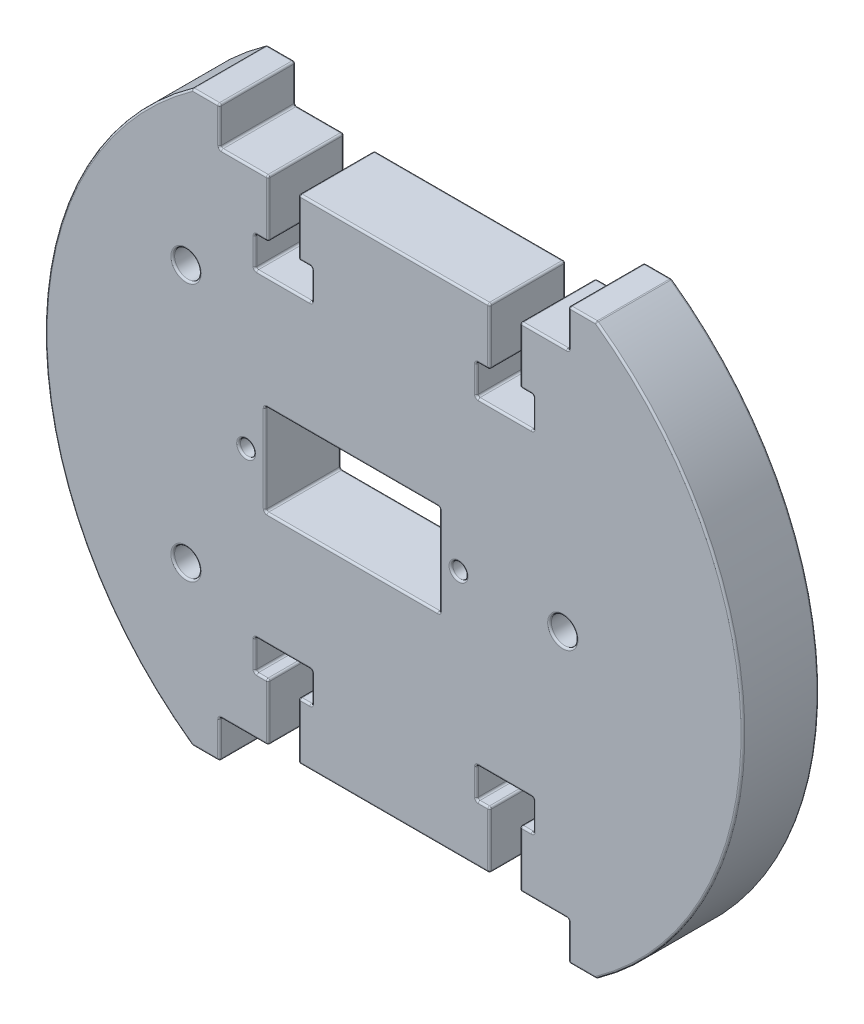
from build123d import *

# Parameters (mm, degrees)
SKETCH1_R           = 1
SKETCH1_R_2         = 1.75
SKETCH1_W           = 23
SKETCH1_H           = 12
BOSS_EXTRUDE1_DEPTH = 10
SKETCH2_W           = 4
SKETCH2_H           = 7.5
SKETCH2_W_2         = 7.5
SKETCH2_H_2         = 4
CUT_EXTRUDE1_DEPTH  = 61.185131054
FILLET1_R           = 0.25


with BuildPart() as part:
    # Sketch1 → Boss-Extrude1 (new body)
    with BuildSketch(Plane.XY):
        with BuildLine():
            Line((26.64113361, 37.5), (23, 37.5))
            Line((23, 37.5), (23, 32.5))
            Line((23, 32.5), (-23, 32.5))
            Line((-23, 32.5), (-23, 37.5))
            Line((-23, 37.5), (-26.64113361, 37.5))
            ThreePointArc((-26.64113361, 37.5), (-46, 0), (-26.64113361, -37.5))
            Line((-26.64113361, -37.5), (-23, -37.5))
            Line((-23, -37.5), (-23, -32.5))
            Line((-23, -32.5), (23, -32.5))
            Line((23, -32.5), (23, -37.5))
            Line((23, -37.5), (26.64113361, -37.5))
            ThreePointArc((26.64113361, -37.5), (46, 0), (26.64113361, 37.5))
        make_face()
        with Locations((8.5, 0)):
            Circle(SKETCH1_R, mode=Mode.SUBTRACT)
        with Locations((-19.5, 0)):
            Circle(SKETCH1_R, mode=Mode.SUBTRACT)
        with Locations((-27.432737229, -17.000515805)):
            Circle(SKETCH1_R_2, mode=Mode.SUBTRACT)
        with Locations((22.25, 0)):
            Circle(SKETCH1_R_2, mode=Mode.SUBTRACT)
        with Locations((-27.432737229, 17.000515805)):
            Circle(SKETCH1_R_2, mode=Mode.SUBTRACT)
        with Locations((-5.5, 0)):
            Rectangle(SKETCH1_W, SKETCH1_H, mode=Mode.SUBTRACT)
    extrude(amount=BOSS_EXTRUDE1_DEPTH)

    # Sketch2 → Cut-Extrude1 (cut, through all)
    with BuildSketch(Plane(origin=(0, 0, 0), x_dir=(-1, 0, 0), z_dir=(0, 0, -1))):
        with Locations((-14.6, 28.75)):
            Rectangle(SKETCH2_W, SKETCH2_H)
        Polygon((-12.6, 25), (-16.6, 25), (-18.35, 25), (-18.35, 21), (-10.85, 21), (-10.85, 25), align=None)
        with Locations((14.6, 28.75)):
            Rectangle(SKETCH2_W, SKETCH2_H)
        with Locations((14.6, 23)):
            Rectangle(SKETCH2_W_2, SKETCH2_H_2)
        with Locations((-14.6, -28.75)):
            Rectangle(SKETCH2_W, SKETCH2_H)
        with Locations((-14.6, -23)):
            Rectangle(SKETCH2_W_2, SKETCH2_H_2)
        Polygon((12.6, -25), (16.6, -25), (18.35, -25), (18.35, -21), (10.85, -21), (10.85, -25), align=None)
        with Locations((14.6, -28.75)):
            Rectangle(SKETCH2_W, SKETCH2_H)
    extrude(amount=-CUT_EXTRUDE1_DEPTH, mode=Mode.SUBTRACT)

    # Fillet1
    fillet1_edges = [part.edges().sort_by_distance(p)[0] for p in [
        (23, 35, 10),
        (-16.6, 28.75, 0),
        (-16.6, 32.5, 5),
        (-17.475, 25, 10),
        (-16.6, 25, 5),
        (-18.35, 23, 0),
        (-18.35, 25, 5),
        (-14.6, 21, 0),
        (-18.35, 21, 5),
        (-10.85, 23, 10),
        (-10.85, 21, 5),
        (-11.725, 25, 10),
        (-10.85, 25, 5),
        (-12.6, 28.75, 10),
        (-12.6, 25, 5),
        (-12.6, 32.5, 5),
        (-16.6, 28.75, 10),
        (-18.35, 23, 10),
        (-14.6, 21, 10),
        (-12.6, 28.75, 0),
        (-11.725, 25, 0),
        (-10.85, 23, 0),
        (-17.475, 25, 0),
        (24.820566805, -37.5, 0),
        (23, -35, 0),
        (16.6, -28.75, 0),
        (16.6, -32.5, 5),
        (17.475, -25, 10),
        (16.6, -25, 5),
        (18.35, -23, 0),
        (18.35, -25, 5),
        (14.6, -21, 0),
        (18.35, -21, 5),
        (10.85, -23, 10),
        (10.85, -21, 5),
        (11.725, -25, 10),
        (-19.8, -32.5, 0),
        (10.85, -25, 5),
        (12.6, -28.75, 10),
        (12.6, -25, 5),
        (12.6, -32.5, 5),
        (16.6, -28.75, 10),
        (18.35, -23, 10),
        (14.6, -21, 10),
        (12.6, -28.75, 0),
        (11.725, -25, 0),
        (10.85, -23, 0),
        (17.475, -25, 0),
        (-23, -35, 0),
        (-24.820566805, -37.5, 0),
        (-10.85, -23, 0),
        (-10.85, -25, 5),
        (-14.6, -21, 10),
        (-10.85, -21, 5),
        (-18.35, -23, 10),
        (-18.35, -21, 5),
        (-17.475, -25, 0),
        (-18.35, -25, 5),
        (-16.6, -28.75, 10),
        (-16.6, -25, 5),
        (-46, 0, 0),
        (-16.6, -32.5, 5),
        (-12.6, -28.75, 0),
        (-12.6, -32.5, 5),
        (-11.725, -25, 0),
        (19.8, 32.5, 10),
        (-12.6, -25, 5),
        (-10.85, -23, 10),
        (-17.475, -25, 10),
        (-12.6, -28.75, 10),
        (-11.725, -25, 10),
        (-16.6, -28.75, 0),
        (-18.35, -23, 0),
        (-14.6, -21, 0),
        (-24.820566805, 37.5, 0),
        (-23, 35, 0),
        (12.6, 28.75, 0),
        (12.6, 32.5, 5),
        (11.725, 25, 0),
        (12.6, 25, 5),
        (10.85, 23, 0),
        (10.85, 25, 5),
        (14.6, 21, 10),
        (10.85, 21, 5),
        (18.35, 23, 10),
        (18.35, 21, 5),
        (19.8, 32.5, 0),
        (17.475, 25, 0),
        (18.35, 25, 5),
        (16.6, 28.75, 10),
        (16.6, 25, 5),
        (16.6, 32.5, 5),
        (12.6, 28.75, 10),
        (11.725, 25, 10),
        (10.85, 23, 10),
        (17.475, 25, 10),
        (16.6, 28.75, 0),
        (18.35, 23, 0),
        (14.6, 21, 0),
        (23, 35, 0),
        (24.820566805, 37.5, 0),
        (46, 0, 0),
        (-23, 35, 10),
        (-24.820566805, 37.5, 10),
        (26.64113361, -37.5, 5),
        (23, -37.5, 5),
        (23, -32.5, 5),
        (-23, -32.5, 5),
        (-23, -37.5, 5),
        (-26.64113361, -37.5, 5),
        (-26.64113361, 37.5, 5),
        (-23, 37.5, 5),
        (-23, 32.5, 5),
        (23, 32.5, 5),
        (23, 37.5, 5),
        (26.64113361, 37.5, 5),
        (-46, 0, 10),
        (-24.820566805, -37.5, 10),
        (-23, -35, 10),
        (-19.8, -32.5, 10),
        (-17, 0, 0),
        (-17, 6, 5),
        (-5.5, -6, 0),
        (-17, -6, 5),
        (6, 0, 0),
        (6, -6, 5),
        (-5.5, 6, 0),
        (6, 6, 5),
        (23, -35, 10),
        (-17, 0, 10),
        (-5.5, -6, 10),
        (6, 0, 10),
        (-5.5, 6, 10),
        (24.820566805, -37.5, 10),
        (46, 0, 10),
        (7.5, 0, 0),
        (7.5, 0, 10),
        (-20.5, 0, 0),
        (-20.5, 0, 10),
        (20.5, 0, 0),
        (20.5, 0, 10),
        (-29.182737229, 17.000515805, 0),
        (-29.182737229, 17.000515805, 10),
        (-29.182737229, -17.000515805, 0),
        (-29.182737229, -17.000515805, 10),
        (24.820566805, 37.5, 10),
        (0, -32.5, 0),
        (19.8, -32.5, 0),
        (0, -32.5, 10),
        (19.8, -32.5, 10),
        (0, 32.5, 0),
        (-19.8, 32.5, 0),
        (0, 32.5, 10),
        (-19.8, 32.5, 10),
    ]]
    fillet(fillet1_edges, radius=FILLET1_R)


solid = part.part
